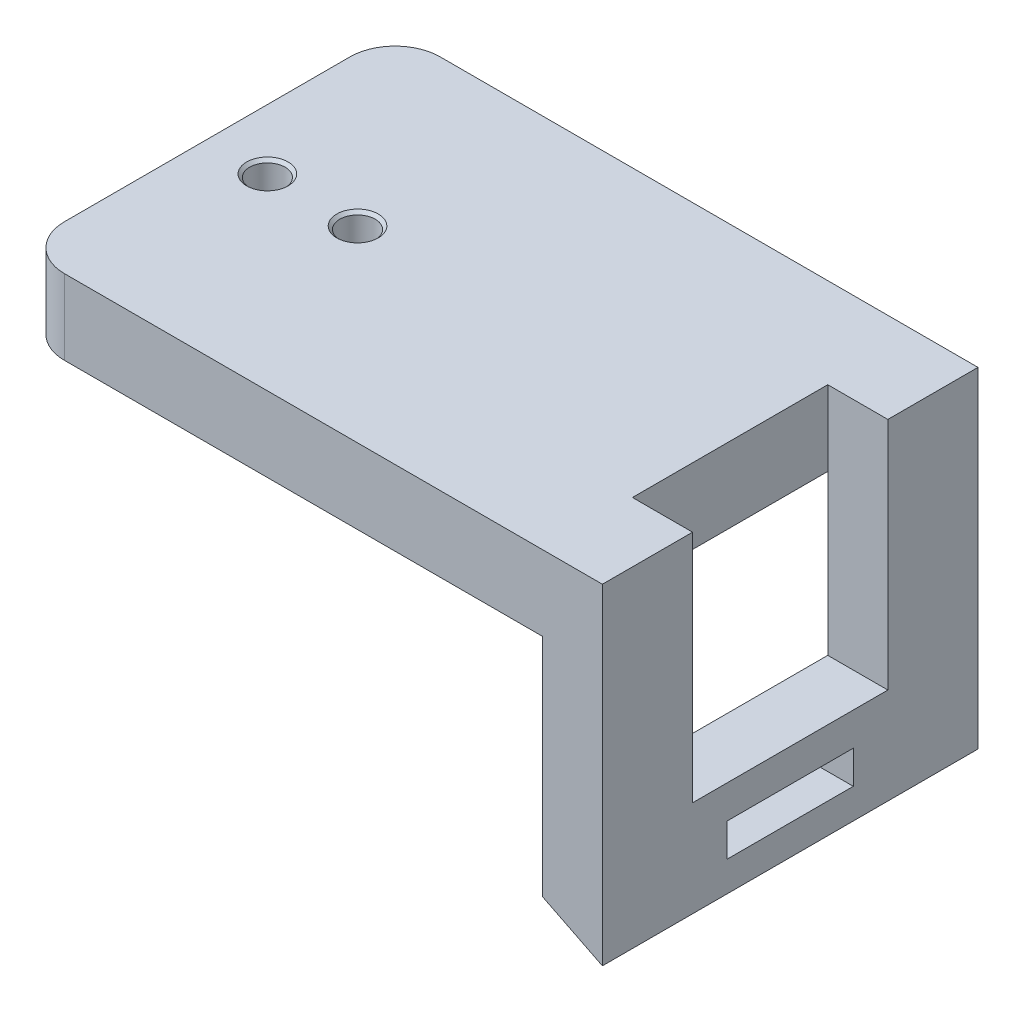
from build123d import *

# Parameters (mm, degrees)
SKETCH1_W             = 44.196
SKETCH1_H             = 31.75
BOSS_EXTRUDE1_DEPTH   = 6.35
F_3_0MM_DOWEL_HOLE1_D = 3
CHAMFER1_SIZE         = 0.254
FILLET2_R             = 3.81
BOSS_EXTRUDE4_DEPTH   = 5.08
SKETCH7_W             = 10.668
SKETCH7_H             = 2.794
CUT_EXTRUDE1_DEPTH    = 58.656321561
SKETCH8_W             = 5.08
SKETCH8_H             = 31.75
BOSS_EXTRUDE5_DEPTH   = 2.54
CUT_EXTRUDE2_DEPTH    = 63.468510275
SKETCH10_W            = 5.08
SKETCH10_H            = 16.51
CUT_EXTRUDE3_DEPTH    = 2.032


with BuildPart() as part:
    # Sketch1 → Boss-Extrude1 (new body)
    with BuildSketch(Plane(origin=(0, 0, 0), x_dir=(1, 0, 0), z_dir=(0, 1, 0))):
        with Locations((22.098, 15.875)):
            Rectangle(SKETCH1_W, SKETCH1_H)
    extrude(amount=BOSS_EXTRUDE1_DEPTH)

    # Ø3.0mm Dowel Hole1 (through all)
    with Locations(Plane(origin=(0, 6.35, 0), x_dir=(1, 0, 0), z_dir=(0, 1, 0))):
        with Locations((5.08, 15.875), (12.7, 15.875)):
            Hole(F_3_0MM_DOWEL_HOLE1_D / 2)

    # Chamfer1
    chamfer1_edges = [part.edges().sort_by_distance(p)[0] for p in [
        (14.2, 6.35, -15.875),
        (14.2, 0, -15.875),
        (6.58, 6.35, -15.875),
        (6.58, 0, -15.875),
    ]]
    chamfer(chamfer1_edges, length=CHAMFER1_SIZE)

    # Fillet2
    fillet2_edges = [part.edges().sort_by_distance(p)[0] for p in [
        (0, 3.175, -31.75),
        (0, 3.175, 0),
    ]]
    fillet(fillet2_edges, radius=FILLET2_R)

    # Sketch6 → Boss-Extrude4 (add)
    with BuildSketch(Plane(origin=(44.196, 0, 0), x_dir=(0, 0, -1), z_dir=(1, 0, 0))):
        Polygon((0, 6.35), (0, -19.05), (31.75, -19.05), (31.75, 6.35), (24.13, 6.35), (24.13, -11.43), (7.62, -11.43), (7.62, 6.35), align=None)
    extrude(amount=BOSS_EXTRUDE4_DEPTH)

    # Sketch7 → Cut-Extrude1 (cut, through all)
    with BuildSketch(Plane.ZY.offset(-44.196)):
        with Locations((-15.875, -17.653)):
            Rectangle(SKETCH7_W, SKETCH7_H)
    extrude(amount=-CUT_EXTRUDE1_DEPTH, mode=Mode.SUBTRACT)

    # Sketch8 → Boss-Extrude5 (add)
    with BuildSketch(Plane.XZ.offset(19.05)):
        with Locations((46.736, -15.875)):
            Rectangle(SKETCH8_W, SKETCH8_H)
    extrude(amount=BOSS_EXTRUDE5_DEPTH)

    # Sketch9 → Cut-Extrude2 (cut, through all)
    with BuildSketch(Plane(origin=(0, 0, -31.75), x_dir=(-1, 0, 0), z_dir=(0, 0, -1))):
        Polygon((-49.276, -21.59), (-44.196, -19.05), (-44.196, -21.59), align=None)
    extrude(amount=-CUT_EXTRUDE2_DEPTH, mode=Mode.SUBTRACT)

    # Sketch10 → Cut-Extrude3 (cut)
    with BuildSketch(Plane(origin=(0, -11.43, 0), x_dir=(1, 0, 0), z_dir=(0, 1, 0))):
        with Locations((46.736, 15.875)):
            Rectangle(SKETCH10_W, SKETCH10_H)
    extrude(amount=-CUT_EXTRUDE3_DEPTH, mode=Mode.SUBTRACT)


solid = part.part
